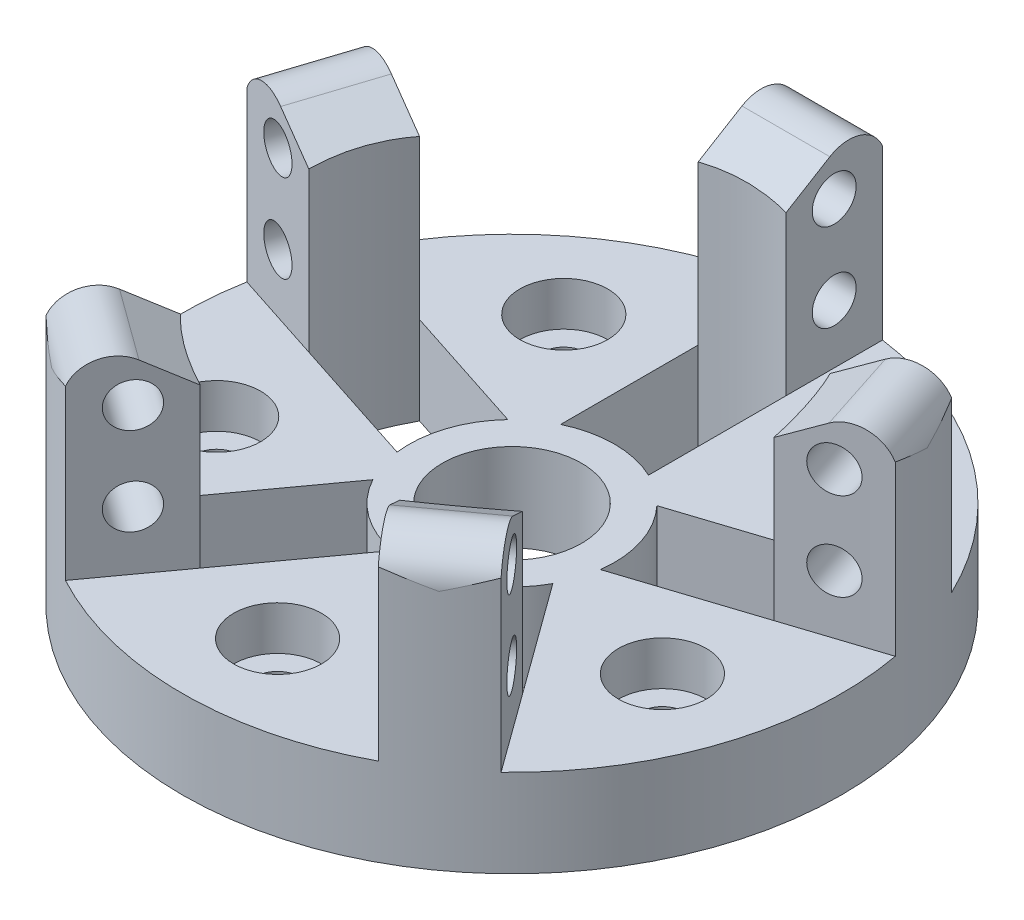
from build123d import *

# Parameters (mm, degrees)
SKETCH_1_R               = 45
SKETCH_1_R_2             = 3
SKETCH_1_R_3             = 9.5
EXTRUDE_1_DEPTH          = 12
SKETCH_2_R               = 3
EXTRUDE_2_DEPTH          = 6
PATTERN_CIRCULAR_1_COUNT = 5
SKETCH_3_R               = 32
CUT_EXTRUDE_1_DEPTH      = 69.745908969
SKETCH_3_4_R             = 57.935065027
SKETCH_3_4_R_2           = 45
CUT_EXTRUDE_2_DEPTH      = 69.745908969
SKETCH_4_R               = 6
CUT_EXTRUDE_3_DEPTH      = 6
CUT_EXTRUDE_4_DEPTH      = 69.745909138


with BuildPart() as part:
    # 草图1 → 凸台-拉伸1 (new body)
    with BuildSketch(Plane(origin=(0, 0, 0), x_dir=(1, 0, 0), z_dir=(0, 1, 0))):
        Circle(SKETCH_1_R)
        with Locations((0, -32)):
            Circle(SKETCH_1_R_2, mode=Mode.SUBTRACT)
        with Locations((-30.433808521, -9.88854382)):
            Circle(SKETCH_1_R_2, mode=Mode.SUBTRACT)
        with Locations((-18.809128073, 25.88854382)):
            Circle(SKETCH_1_R_2, mode=Mode.SUBTRACT)
        with Locations((18.809128073, 25.88854382)):
            Circle(SKETCH_1_R_2, mode=Mode.SUBTRACT)
        with Locations((30.433808521, -9.88854382)):
            Circle(SKETCH_1_R_2, mode=Mode.SUBTRACT)
        Circle(SKETCH_1_R_3, mode=Mode.SUBTRACT)
        with BuildLine():
            Line((11.268756107, 8.307534882), (28.776814381, 13.996247858))
            ThreePointArc((28.776814381, 13.996247858), (30.433808521, 9.88854382), (31.507719956, 5.591384727))
            Line((31.507719956, 5.591384727), (13.999661682, -0.097328249))
            ThreePointArc((13.999661682, -0.097328249), (13.314791228, 4.326237921), (11.268756107, 8.307534882))
        make_face(mode=Mode.SUBTRACT)
        with BuildLine():
            Line((-4.418698041, 13.284393386), (-4.418698041, 31.693455281))
            ThreePointArc((-4.418698041, 31.693455281), (0, 32), (4.418698041, 31.693455281))
            Line((4.418698041, 31.693455281), (4.418698041, 13.284393386))
            ThreePointArc((4.418698041, 13.284393386), (0, 14), (-4.418698041, 13.284393386))
        make_face(mode=Mode.SUBTRACT)
        with BuildLine():
            Line((11.383172326, -8.150054466), (22.203747416, -23.04329839))
            ThreePointArc((22.203747416, -23.04329839), (18.809128073, -25.88854382), (15.0541438, -28.237789475))
            Line((15.0541438, -28.237789475), (4.233568709, -13.344545552))
            ThreePointArc((4.233568709, -13.344545552), (8.228993532, -11.326237921), (11.383172326, -8.150054466))
        make_face(mode=Mode.SUBTRACT)
        with BuildLine():
            Line((-4.233568709, -13.344545552), (-15.0541438, -28.237789475))
            ThreePointArc((-15.0541438, -28.237789475), (-18.809128073, -25.88854382), (-22.203747416, -23.04329839))
            Line((-22.203747416, -23.04329839), (-11.383172326, -8.150054466))
            ThreePointArc((-11.383172326, -8.150054466), (-8.228993532, -11.326237921), (-4.233568709, -13.344545552))
        make_face(mode=Mode.SUBTRACT)
        with BuildLine():
            Line((-13.999661682, -0.097328249), (-31.507719956, 5.591384727))
            ThreePointArc((-31.507719956, 5.591384727), (-30.433808521, 9.88854382), (-28.776814381, 13.996247858))
            Line((-28.776814381, 13.996247858), (-11.268756107, 8.307534882))
            ThreePointArc((-11.268756107, 8.307534882), (-13.314791228, 4.326237921), (-13.999661682, -0.097328249))
        make_face(mode=Mode.SUBTRACT)
    extrude(amount=EXTRUDE_1_DEPTH)

    # 草图2 → 凸台-拉伸2 (add, symmetric)
    with BuildSketch(Plane(origin=(0, 0, 0), x_dir=(0, 0, -1), z_dir=(1, 0, 0))):
        with BuildLine():
            Line((45, 12), (45, 33))
            ThreePointArc((45, 33), (42.454374247, 37.356150486), (37.409581178, 37.276649428))
            Line((37.409581178, 37.276649428), (28.758557392, 32.0366186))
            Line((28.758557392, 32.0366186), (28.758557392, 12))
            Line((28.758557392, 12), (45, 12))
        make_face()
        with Locations((38, 32)):
            Circle(SKETCH_2_R, mode=Mode.SUBTRACT)
        with Locations((38, 20)):
            Circle(SKETCH_2_R, mode=Mode.SUBTRACT)
    extrude_2 = extrude(amount=EXTRUDE_2_DEPTH, both=True)

    # 阵列(圆周)1: 凸台-拉伸2 ×5 about axis
    pattern_circular_1_axis = Axis((0, 12, 0), (0, 1, 0))
    for i in range(1, PATTERN_CIRCULAR_1_COUNT):
        add(extrude_2.rotate(pattern_circular_1_axis, i * 360 / PATTERN_CIRCULAR_1_COUNT))

    # 草图3 → 切除-拉伸1 (cut, through all)
    with BuildSketch(Plane.XZ.offset(-12)):
        Circle(SKETCH_3_R)
    extrude(amount=-CUT_EXTRUDE_1_DEPTH, mode=Mode.SUBTRACT)

    # 草图3<4> → 切除-拉伸2 (cut, through all)
    with BuildSketch(Plane.XZ.offset(-12)):
        Circle(SKETCH_3_4_R)
        Circle(SKETCH_3_4_R_2, mode=Mode.SUBTRACT)
    extrude(amount=-CUT_EXTRUDE_2_DEPTH, mode=Mode.SUBTRACT)

    # 草图4 → 切除-拉伸3 (cut)
    with BuildSketch(Plane(origin=(0, 12, 0), x_dir=(1, 0, 0), z_dir=(0, 1, 0))):
        with Locations((30.433808521, -9.88854382)):
            Circle(SKETCH_4_R)
        with Locations((0, -32)):
            Circle(SKETCH_4_R)
        with Locations((-30.433808521, -9.88854382)):
            Circle(SKETCH_4_R)
        with Locations((-18.809128073, 25.88854382)):
            Circle(SKETCH_4_R)
        with Locations((18.809128073, 25.88854382)):
            Circle(SKETCH_4_R)
    extrude(amount=-CUT_EXTRUDE_3_DEPTH, mode=Mode.SUBTRACT)

    # 草图5 → 切除-拉伸4 (cut, through all)
    with BuildSketch(Plane(origin=(0, 12, 0), x_dir=(1, 0, 0), z_dir=(0, 1, 0))):
        with BuildLine():
            Line((6, 31.432467291), (6, 12.649110641))
            ThreePointArc((6, 12.649110641), (0, 14), (-6, 12.649110641))
            Line((-6, 12.649110641), (-6, 31.432467291))
            ThreePointArc((-6, 31.432467291), (0, 32), (6, 31.432467291))
        make_face()
        with BuildLine():
            Line((31.748154807, 4.00682747), (13.884121066, -1.797548946))
            ThreePointArc((13.884121066, -1.797548946), (13.314791228, 4.326237921), (10.175917134, 9.615129249))
            Line((10.175917134, 9.615129249), (28.039950874, 15.419505666))
            ThreePointArc((28.039950874, 15.419505666), (30.433808521, 9.88854382), (31.748154807, 4.00682747))
        make_face()
        with BuildLine():
            Line((13.621438751, -28.956111727), (2.580858723, -13.760056986))
            ThreePointArc((2.580858723, -13.760056986), (8.228993532, -11.326237921), (12.289062655, -6.706633958))
            Line((12.289062655, -6.706633958), (23.329642683, -21.9026887))
            ThreePointArc((23.329642683, -21.9026887), (18.809128073, -25.88854382), (13.621438751, -28.956111727))
        make_face()
        with BuildLine():
            Line((-23.329642683, -21.9026887), (-12.289062655, -6.706633958))
            ThreePointArc((-12.289062655, -6.706633958), (-8.228993532, -11.326237921), (-2.580858723, -13.760056986))
            Line((-2.580858723, -13.760056986), (-13.621438751, -28.956111727))
            ThreePointArc((-13.621438751, -28.956111727), (-18.809128073, -25.88854382), (-23.329642683, -21.9026887))
        make_face()
        with BuildLine():
            Line((-28.039950874, 15.419505666), (-10.175917134, 9.615129249))
            ThreePointArc((-10.175917134, 9.615129249), (-13.314791228, 4.326237921), (-13.884121066, -1.797548946))
            Line((-13.884121066, -1.797548946), (-31.748154807, 4.00682747))
            ThreePointArc((-31.748154807, 4.00682747), (-30.433808521, 9.88854382), (-28.039950874, 15.419505666))
        make_face()
    extrude(amount=-CUT_EXTRUDE_4_DEPTH, mode=Mode.SUBTRACT)


solid = part.part
